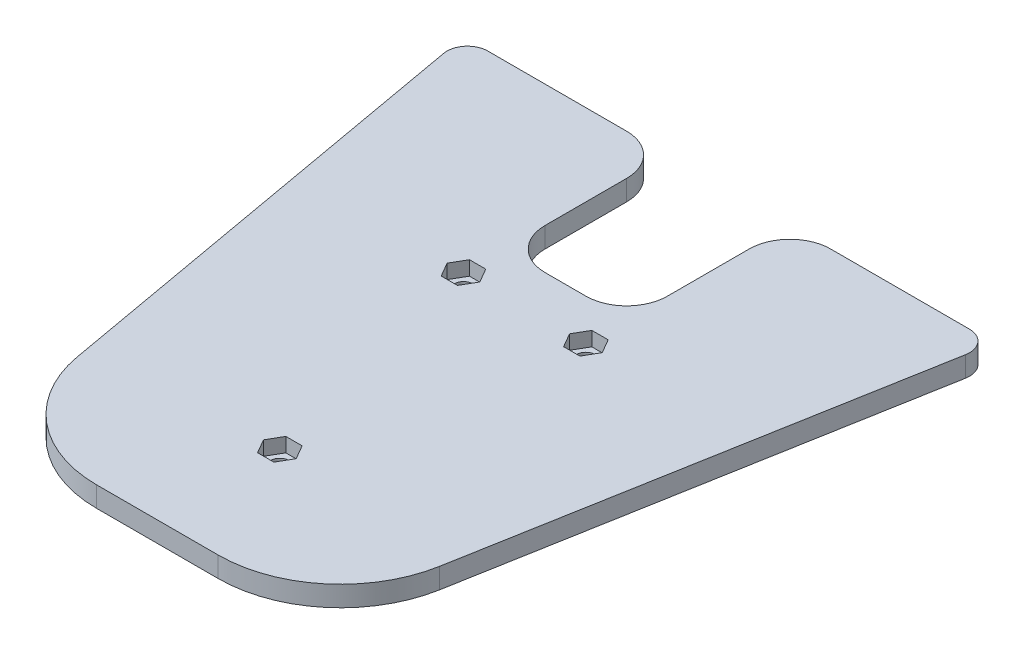
from build123d import *

# Parameters (mm, degrees)
BOSS_EXTRUDE1_DEPTH = 5
SKETCH2_R           = 2.25
CUT_EXTRUDE1_DEPTH  = 5
FILLET7_R           = 30
FILLET8_R           = 30
FILLET9_R           = 10
FILLET10_R          = 10
FILLET11_R          = 10
FILLET12_R          = 10
FILLET13_R          = 5
FILLET14_R          = 5
CUT_EXTRUDE2_DEPTH  = 3.5


with BuildPart() as part:
    # Sketch1 → Boss-Extrude1 (new body)
    with BuildSketch(Plane(origin=(0, 0, 0), x_dir=(1, 0, 0), z_dir=(0, 1, 0))):
        Polygon((-15, 40), (-15, 80), (-65, 80), (-40, -60), (0, -60), (40, -60), (65, 80), (15, 80), (15, 40), align=None)
    extrude(amount=BOSS_EXTRUDE1_DEPTH)

    # Sketch2 → Cut-Extrude1 (cut)
    with BuildSketch(Plane(origin=(0, 5, 0), x_dir=(1, 0, 0), z_dir=(0, 1, 0))):
        with Locations(Location((0, -30, 0), (0, 0, 270))):
            Circle(SKETCH2_R)
        with Locations(Location((-15, 30, 0), (0, 0, 270))):
            Circle(SKETCH2_R)
        with Locations(Location((15, 30, 0), (0, 0, 270))):
            Circle(SKETCH2_R)
    extrude(amount=-CUT_EXTRUDE1_DEPTH, mode=Mode.SUBTRACT)

    # Fillet7
    fillet7_edges = [part.edges().sort_by_distance(p)[0] for p in [
        (-40, 2.5, 60),
    ]]
    fillet(fillet7_edges, radius=FILLET7_R)

    # Fillet8
    fillet8_edges = [part.edges().sort_by_distance(p)[0] for p in [
        (40, 2.5, 60),
    ]]
    fillet(fillet8_edges, radius=FILLET8_R)

    # Fillet9
    fillet9_edges = [part.edges().sort_by_distance(p)[0] for p in [
        (15, 2.5, -80),
    ]]
    fillet(fillet9_edges, radius=FILLET9_R)

    # Fillet10
    fillet10_edges = [part.edges().sort_by_distance(p)[0] for p in [
        (-15, 2.5, -80),
    ]]
    fillet(fillet10_edges, radius=FILLET10_R)

    # Fillet11
    fillet11_edges = [part.edges().sort_by_distance(p)[0] for p in [
        (15, 2.5, -40),
    ]]
    fillet(fillet11_edges, radius=FILLET11_R)

    # Fillet12
    fillet12_edges = [part.edges().sort_by_distance(p)[0] for p in [
        (-15, 2.5, -40),
    ]]
    fillet(fillet12_edges, radius=FILLET12_R)

    # Fillet13
    fillet13_edges = [part.edges().sort_by_distance(p)[0] for p in [
        (65, 2.5, -80),
    ]]
    fillet(fillet13_edges, radius=FILLET13_R)

    # Fillet14
    fillet14_edges = [part.edges().sort_by_distance(p)[0] for p in [
        (-65, 2.5, -80),
    ]]
    fillet(fillet14_edges, radius=FILLET14_R)

    # Sketch3 → Cut-Extrude2 (cut)
    with BuildSketch(Plane(origin=(0, 5, 0), x_dir=(1, 0, 0), z_dir=(0, 1, 0))):
        Polygon((-4, -30), (-2, -33.464101615), (2, -33.464101615), (4, -30), (2, -26.535898385), (-2, -26.535898385), align=None)
        Polygon((-11, 30), (-13, 33.464101615), (-17, 33.464101615), (-19, 30), (-17, 26.535898385), (-13, 26.535898385), align=None)
        Polygon((19, 30), (17, 33.464101615), (13, 33.464101615), (11, 30), (13, 26.535898385), (17, 26.535898385), align=None)
    extrude(amount=-CUT_EXTRUDE2_DEPTH, mode=Mode.SUBTRACT)


solid = part.part
